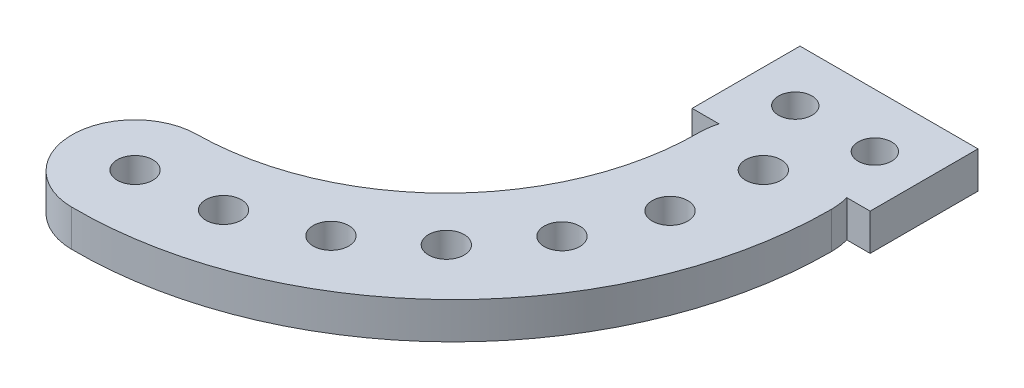
from build123d import *

# Parameters (mm, degrees)
ESBO_O1_W                = 50
ESBO_O1_H                = 11
RESSALTO_EXTRUS_O1_DEPTH = 22.5
ESBO_O2_W                = 46
ESBO_O2_H                = 7
CORTE_EXTRUS_O1_DEPTH    = 20.5
ESBO_O3_W                = 10.97916057
ESBO_O3_H                = 2
CORTE_EXTRUS_O2_DEPTH    = 4
CORTE_EXTRUS_O3_DEPTH    = 4
ESBO_O9_W                = 50
ESBO_O9_H                = 4
RESSALTO_EXTRUS_O4_DEPTH = 7
ESBO_O13_R               = 1.5
CORTE_EXTRUS_O4_DEPTH    = 7
ESBO_O19_W               = 9
ESBO_O19_H               = 4
RESSALTO_EXTRUS_O5_DEPTH = 22.5
ESBO_O20_R               = 1.7
RESSALTO_EXTRUS_O7_DEPTH = 3.5
ESBO_O21_W               = 68.510383691
ESBO_O21_H               = 66.833312069
CORTE_EXTRUS_O7_DEPTH    = 50.144843501
CORTE_EXTRUS_O8_DEPTH    = 35.762993058
RESSALTO_EXTRUS_O9_DEPTH = 3.5
ESBO_O24_R               = 1.6
CORTE_EXTRUS_O9_DEPTH    = 3.5


with BuildPart() as part:
    # Esboço1 → Ressalto-extrusão1 (new body)
    with BuildSketch(Plane(origin=(0, 0, 0), x_dir=(1, 0, 0), z_dir=(0, 1, 0))):
        Rectangle(ESBO_O1_W, ESBO_O1_H)
    extrude(amount=RESSALTO_EXTRUS_O1_DEPTH)

    # Esboço2 → Corte-extrusão1 (cut)
    with BuildSketch(Plane(origin=(0, 22.5, 0), x_dir=(1, 0, 0), z_dir=(0, 1, 0))):
        Rectangle(ESBO_O2_W, ESBO_O2_H)
    extrude(amount=-CORTE_EXTRUS_O1_DEPTH, mode=Mode.SUBTRACT)

    # Esboço3 → Corte-extrusão2 (cut)
    with BuildSketch(Plane(origin=(0, 22.5, 0), x_dir=(1, 0, 0), z_dir=(0, 1, 0))):
        with Locations((0, 4.5)):
            Rectangle(ESBO_O3_W, ESBO_O3_H)
    extrude(amount=-CORTE_EXTRUS_O2_DEPTH, mode=Mode.SUBTRACT)

    # Esboço5 → Corte-extrusão3 (cut)
    with BuildSketch(Plane.XY.offset(5.5)):
        with BuildLine():
            Line((-21, 22.5), (-4.5, 22.5))
            Line((-4.5, 22.5), (-4.5, 11.75))
            ThreePointArc((-4.5, 11.75), (-12.75, 3.5), (-21, 11.75))
            Line((-21, 11.75), (-21, 22.5))
        make_face()
        with BuildLine():
            Line((4.5, 22.5), (21, 22.5))
            Line((21, 22.5), (21, 11.75))
            ThreePointArc((21, 11.75), (12.75, 3.5), (4.5, 11.75))
            Line((4.5, 11.75), (4.5, 22.5))
        make_face()
    extrude(amount=-CORTE_EXTRUS_O3_DEPTH, mode=Mode.SUBTRACT)

    # Esboço9 → Ressalto-extrusão4 (add)
    with BuildSketch(Plane(origin=(0, 0, -5.5), x_dir=(-1, 0, 0), z_dir=(0, 0, -1))):
        with Locations((0, 2)):
            Rectangle(ESBO_O9_W, ESBO_O9_H)
    extrude(amount=RESSALTO_EXTRUS_O4_DEPTH)

    # Esboço13 → Corte-extrusão4 (cut)
    with BuildSketch(Plane(origin=(0, 4, 0), x_dir=(1, 0, 0), z_dir=(0, 1, 0))):
        with Locations(Location((10, 9, 0), (0, 0, 270))):
            Circle(ESBO_O13_R)
        with Locations(Location((5, 9, 0), (0, 0, 270))):
            Circle(ESBO_O13_R)
        with Locations(Location((20, 9, 0), (0, 0, 270))):
            Circle(ESBO_O13_R)
        with Locations(Location((15, 9, 0), (0, 0, 270))):
            Circle(ESBO_O13_R)
        with Locations(Location((0, 9, 0), (0, 0, 270))):
            Circle(ESBO_O13_R)
        with Locations(Location((-5, 9, 0), (0, 0, 270))):
            Circle(ESBO_O13_R)
        with Locations(Location((-10, 9, 0), (0, 0, 270))):
            Circle(ESBO_O13_R)
        with Locations(Location((-15, 9, 0), (0, 0, 270))):
            Circle(ESBO_O13_R)
        with Locations(Location((-20, 9, 0), (0, 0, 270))):
            Circle(ESBO_O13_R)
    extrude(amount=-CORTE_EXTRUS_O4_DEPTH, mode=Mode.SUBTRACT)

    # Esboço19 → Ressalto-extrusão5 (add)
    with BuildSketch(Plane(origin=(0, 22.5, 0), x_dir=(1, 0, 0), z_dir=(0, 1, 0))):
        with Locations((0, -5.5)):
            Rectangle(ESBO_O19_W, ESBO_O19_H)
    extrude(amount=-RESSALTO_EXTRUS_O5_DEPTH)

    # Esboço21 → Corte-extrusão7 (cut, through all)
    with BuildSketch(Plane(origin=(0, 32.5, 0), x_dir=(1, 0, 0), z_dir=(0, 1, 0))):
        with Locations((0.009195905, -3.607588671)):
            Rectangle(ESBO_O21_W, ESBO_O21_H)
    extrude(amount=-CORTE_EXTRUS_O7_DEPTH, mode=Mode.SUBTRACT)


with BuildPart() as body_2:
    # Esboço20 → Ressalto-extrusão7 (new body)
    with BuildSketch(Plane(origin=(0, 32.5, 0), x_dir=(1, 0, 0), z_dir=(0, 1, 0))):
        with BuildLine():
            ThreePointArc((8.833758049, 9), (15.166879024, 15.336707535), (21.5, 9))
            ThreePointArc((21.5, 9), (10.778241796, -16.658684905), (-15, -27.089718411))
            ThreePointArc((-15, -27.089718411), (-20.92850101, -21.097213824), (-15, -15.104709238))
            ThreePointArc((-15, -15.104709238), (1.873258871, -7.953021825), (8.833758049, 9))
        make_face()
        with Locations(Location((15, 9, 0), (0, 0, 270))):
            Circle(ESBO_O20_R, mode=Mode.SUBTRACT)
        with Locations(Location((-15, -21, 0), (0, 0, 270))):
            Circle(ESBO_O20_R, mode=Mode.SUBTRACT)
    extrude(amount=RESSALTO_EXTRUS_O7_DEPTH)

    # Esboço22 → Corte-extrusão8 (cut, through all)
    with BuildSketch(Plane(origin=(0, 36, 0), x_dir=(1, 0, 0), z_dir=(0, 1, 0))):
        with BuildLine():
            ThreePointArc((1.24551884, -16.20086225), (-1.05060257, -15.613093269), (-1.702635259, -17.891798883))
            ThreePointArc((-1.702635259, -17.891798883), (-0.204800523, -17.087752178), (1.24551884, -16.20086225))
        make_face()
        with BuildLine():
            ThreePointArc((1.24551884, -16.20086225), (-0.204800523, -17.087752178), (-1.702635259, -17.891798883))
            ThreePointArc((-1.702635259, -17.891798883), (0.209735934, -18.736436358), (1.495199477, -17.087752178))
            ThreePointArc((1.495199477, -17.087752178), (1.43158924, -16.627069487), (1.24551884, -16.20086225))
        make_face()
        with BuildLine():
            ThreePointArc((-5.840861487, -19.595514274), (-7.908251051, -18.436399829), (-9.12497893, -20.470415359))
            ThreePointArc((-9.12497893, -20.470415359), (-7.470627834, -20.079106718), (-5.840861487, -19.595514274))
        make_face()
        with BuildLine():
            ThreePointArc((-5.840861487, -19.595514274), (-7.470627834, -20.079106718), (-9.12497893, -20.470415359))
            ThreePointArc((-9.12497893, -20.470415359), (-7.273646696, -21.767655927), (-5.770627834, -20.079106718))
            ThreePointArc((-5.770627834, -20.079106718), (-5.788277872, -19.834773739), (-5.840861487, -19.595514274))
        make_face()
        with BuildLine():
            ThreePointArc((7.222954726, -11.091822097), (4.852915515, -11.115487395), (4.809999578, -13.485256187))
            ThreePointArc((4.809999578, -13.485256187), (6.050104938, -12.3224412), (7.222954726, -11.091822097))
        make_face()
        with BuildLine():
            ThreePointArc((7.222954726, -11.091822097), (6.050104938, -12.3224412), (4.809999578, -13.485256187))
            ThreePointArc((4.809999578, -13.485256187), (6.675333252, -13.903292096), (7.750104938, -12.3224412))
            ThreePointArc((7.750104938, -12.3224412), (7.612770072, -11.653055152), (7.222954726, -11.091822097))
        make_face()
        with BuildLine():
            ThreePointArc((11.686065273, -4.607737974), (9.402313913, -5.241871738), (9.972049301, -7.542534141))
            ThreePointArc((9.972049301, -7.542534141), (10.870291219, -6.099218009), (11.686065273, -4.607737974))
        make_face()
        with BuildLine():
            ThreePointArc((11.686065273, -4.607737974), (10.870291219, -6.099218009), (9.972049301, -7.542534141))
            ThreePointArc((9.972049301, -7.542534141), (11.695817941, -7.585322188), (12.570291219, -6.099218009))
            ThreePointArc((12.570291219, -6.099218009), (12.332620849, -5.232273919), (11.686065273, -4.607737974))
        make_face()
        with BuildLine():
            ThreePointArc((14.327996178, 2.818153576), (12.285471778, 1.615764297), (13.430014274, -0.459728025))
            ThreePointArc((13.430014274, -0.459728025), (13.925059514, 1.166596116), (14.327996178, 2.818153576))
        make_face()
        with BuildLine():
            ThreePointArc((14.327996178, 2.818153576), (13.925059514, 1.166596116), (13.430014274, -0.459728025))
            ThreePointArc((13.430014274, -0.459728025), (14.937092886, -0.199342556), (15.625059514, 1.166596116))
            ThreePointArc((15.625059514, 1.166596116), (15.262032275, 2.216597942), (14.327996178, 2.818153576))
        make_face()
    extrude(amount=-CORTE_EXTRUS_O8_DEPTH, mode=Mode.SUBTRACT)

    # Esboço23 → Ressalto-extrusão9 (add)
    with BuildSketch(Plane(origin=(0, 36, 0), x_dir=(1, 0, 0), z_dir=(0, 1, 0))):
        Polygon((15, 10.7), (23.5, 10.7), (23.5, 21), (6.5, 21), (6.5, 10.7), align=None)
    extrude(amount=-RESSALTO_EXTRUS_O9_DEPTH)

    # Esboço24 → Corte-extrusão9 (cut)
    with BuildSketch(Plane(origin=(0, 36, 0), x_dir=(1, 0, 0), z_dir=(0, 1, 0))):
        with Locations(Location((11.2, 15.85, 0), (0, 0, 270))):
            Circle(ESBO_O24_R)
        with Locations(Location((18.8, 15.85, 0), (0, 0, 270))):
            Circle(ESBO_O24_R)
    extrude(amount=-CORTE_EXTRUS_O9_DEPTH, mode=Mode.SUBTRACT)


solid = body_2.part
